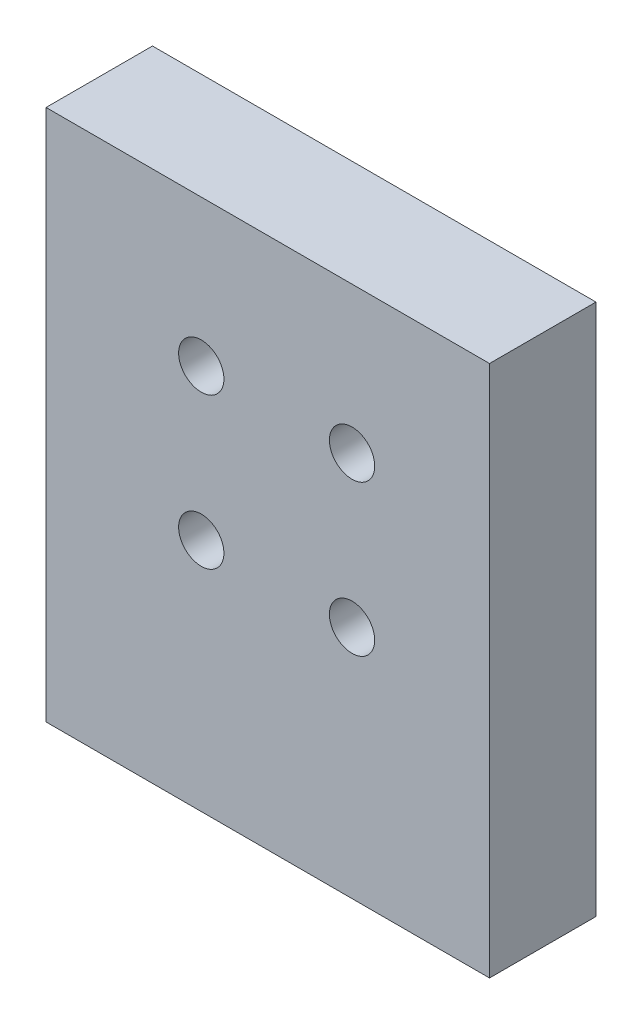
from build123d import *

# Parameters (mm, degrees)
SKETCH1_W                   = 50
SKETCH1_H                   = 60
BOSS_EXTRUDE1_DEPTH         = 12
F_1_4_20_TAPPED_HOLE1_D     = 5.1054
F_1_4_20_TAPPED_HOLE1_DEPTH = 16.51
F_1_4_20_TAPPED_HOLE1_TIP   = 1.533816902
F_8_32_TAPPED_HOLE1_D       = 3.4544
F_8_32_TAPPED_HOLE1_DEPTH   = 12.7
F_8_32_TAPPED_HOLE1_TIP     = 1.037806461


with BuildPart() as part:
    # Sketch1 → Boss-Extrude1 (new body)
    with BuildSketch(Plane.XY):
        Rectangle(SKETCH1_W, SKETCH1_H)
    extrude(amount=BOSS_EXTRUDE1_DEPTH)

    # 1/4-20 Tapped Hole1
    with Locations(Plane.XY.offset(12)):
        with Locations((-7.5, 13.5), (9.5, 13.5), (9.5, -3.5), (-7.5, -3.5)):
            Hole(F_1_4_20_TAPPED_HOLE1_D / 2, depth=F_1_4_20_TAPPED_HOLE1_DEPTH)
            with Locations((0, 0, -(F_1_4_20_TAPPED_HOLE1_DEPTH + F_1_4_20_TAPPED_HOLE1_TIP / 2))):  # 118° drill point
                Cone(0, F_1_4_20_TAPPED_HOLE1_D / 2, F_1_4_20_TAPPED_HOLE1_TIP, mode=Mode.SUBTRACT)

    # #8-32 Tapped Hole1
    with Locations(Plane(origin=(0, -30, 0), x_dir=(-1, 0, 0), z_dir=(0, -1, 0))):
        with Locations((15, -6), (0, -6), (-15, -6)):
            Hole(F_8_32_TAPPED_HOLE1_D / 2, depth=F_8_32_TAPPED_HOLE1_DEPTH)
            with Locations((0, 0, -(F_8_32_TAPPED_HOLE1_DEPTH + F_8_32_TAPPED_HOLE1_TIP / 2))):  # 118° drill point
                Cone(0, F_8_32_TAPPED_HOLE1_D / 2, F_8_32_TAPPED_HOLE1_TIP, mode=Mode.SUBTRACT)


solid = part.part
